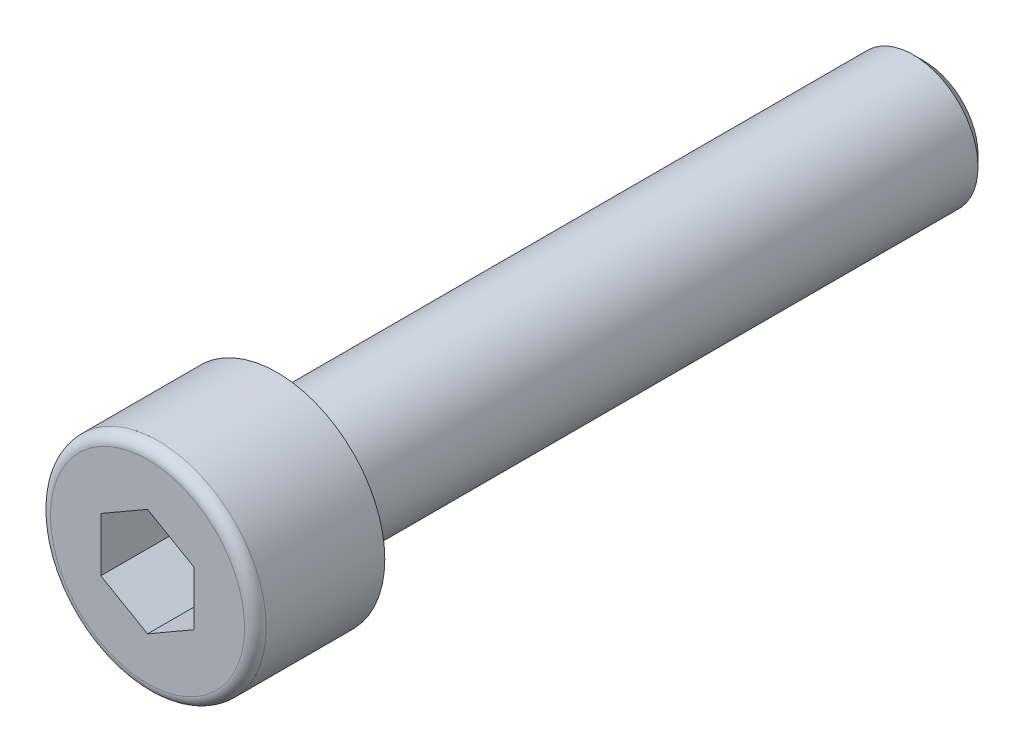
from build123d import *

# Parameters (mm, degrees)
ESQUISSE1_R             = 3
BASE_EXTRUSION_DEPTH    = 36
CHANFREIN1_SIZE         = 0.5
ESQUISSE2_R             = 5
BOSS_EXTRU_1_DEPTH      = 6
ENL_V_MAT_EXTRU_1_DEPTH = 3.5
CONG_2_R                = 0.5


with BuildPart() as part:
    # Esquisse1 → Base-Extrusion (new body)
    with BuildSketch(Plane.XY):
        Circle(ESQUISSE1_R)
    extrude(amount=BASE_EXTRUSION_DEPTH)

    # Chanfrein1
    chanfrein1_edges = [part.edges().sort_by_distance(p)[0] for p in [
        (-3, 0, 0),
    ]]
    chamfer(chanfrein1_edges, length=CHANFREIN1_SIZE)

    # Esquisse2 → Boss.-Extru.1 (add)
    with BuildSketch(Plane.XY.offset(30)):
        Circle(ESQUISSE2_R)
    extrude(amount=BOSS_EXTRU_1_DEPTH)

    # Esquisse3 → Enlèv. mat.-Extru.1 (cut)
    with BuildSketch(Plane.XY.offset(36)):
        Polygon((0, 2.5), (-2.165063509, 1.25), (-2.165063509, -1.25), (0, -2.5), (2.165063509, -1.25), (2.165063509, 1.25), align=None)
    extrude(amount=-ENL_V_MAT_EXTRU_1_DEPTH, mode=Mode.SUBTRACT)

    # Congé2
    cong_2_edges = [part.edges().sort_by_distance(p)[0] for p in [
        (-5, 0, 36),
    ]]
    fillet(cong_2_edges, radius=CONG_2_R)


solid = part.part
